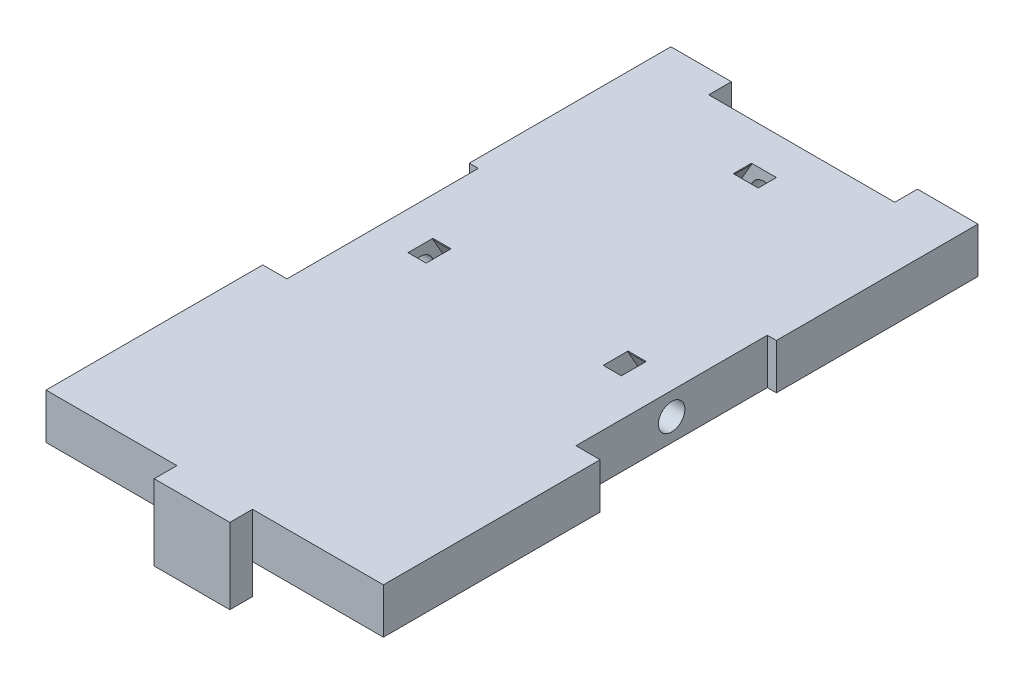
from build123d import *

# Parameters (mm, degrees)
SALIENTE_EXTRUIR1_DEPTH = 6
CROQUIS2_W              = 10
CROQUIS2_H              = 10
SALIENTE_EXTRUIR2_DEPTH = 3
CORTAR_EXTRUIR1_DEPTH   = 2.4
CORTAR_EXTRUIR2_REACH   = 85.843
CROQUIS4_R              = 1.75
CORTAR_EXTRUIR4_DEPTH   = 2.4
CORTAR_EXTRUIR5_REACH   = 62.207
CROQUIS7_R              = 1.75


with BuildPart() as part:
    # Croquis1 → Saliente-Extruir1 (new body)
    with BuildSketch(Plane(origin=(0, 0, 0), x_dir=(1, 0, 0), z_dir=(0, 1, 0))):
        Polygon((-12.3, 40.3), (-12.3, 37.3), (12.3, 37.3), (12.3, 40.3), (20.3, 40.3), (20.3, 13.65), (19.1, 13.65), (19.1, -11.65), (22.3, -11.65), (22.3, -40.3), (20.3, -40.3), (-20.3, -40.3), (-22.3, -40.3), (-22.3, -11.65), (-19.1, -11.65), (-19.1, 13.65), (-20.3, 13.65), (-20.3, 40.3), align=None)
    extrude(amount=SALIENTE_EXTRUIR1_DEPTH)

    # Croquis2 → Saliente-Extruir2 (add)
    with BuildSketch(Plane.XY.offset(40.3)):
        with Locations((0, 1)):
            Rectangle(CROQUIS2_W, CROQUIS2_H)
    extrude(amount=SALIENTE_EXTRUIR2_DEPTH)

    # Croquis3 → Cortar-Extruir1 (cut)
    with BuildSketch(Plane(origin=(0, 0, -32.3), x_dir=(-1, 0, 0), z_dir=(0, 0, -1))):
        Polygon((1.645448267, 5.85), (3.290896534, 3), (3.290896534, 0), (-3.290896534, 0), (-3.290896534, 3), (-1.645448267, 5.85), (-1.645448267, 6), (1.645448267, 6), align=None)
    extrude(amount=-CORTAR_EXTRUIR1_DEPTH, mode=Mode.SUBTRACT)

    # Croquis4 → Cortar-Extruir2 (cut, up to next)
    with BuildSketch(Plane(origin=(0, 0, -37.3), x_dir=(-1, 0, 0), z_dir=(0, 0, -1)), mode=Mode.PRIVATE) as cortar_extruir2_sk1:
        with Locations((0, 3)):
            Circle(CROQUIS4_R)
    cortar_extruir2_tool1 = extrude(cortar_extruir2_sk1.sketch, amount=-CORTAR_EXTRUIR2_REACH, mode=Mode.PRIVATE) & part.part
    add(cortar_extruir2_tool1.solids().sort_by_distance((0, 3, -37.3))[0], mode=Mode.SUBTRACT)

    # Croquis6 → Cortar-Extruir4 (cut)
    with BuildSketch(Plane.ZY.offset(14.1)):
        Polygon((0.645448267, 5.85), (2.290896534, 3), (2.290896534, 0), (-4.290896534, 0), (-4.290896534, 3), (-2.645448267, 5.85), (-2.645448267, 6), (0.645448267, 6), align=None)
    cortar_extruir4 = extrude(amount=-CORTAR_EXTRUIR4_DEPTH, mode=Mode.SUBTRACT)

    # Croquis7 → Cortar-Extruir5 (cut, up to next)
    with BuildSketch(Plane.ZY.offset(19.1), mode=Mode.PRIVATE) as cortar_extruir5_sk1:
        with Locations((-1, 3)):
            Circle(CROQUIS7_R)
    cortar_extruir5_tool1 = extrude(cortar_extruir5_sk1.sketch, amount=-CORTAR_EXTRUIR5_REACH, mode=Mode.PRIVATE) & part.part
    cortar_extruir5 = cortar_extruir5_tool1.solids().sort_by_distance((-19.1, 3, -1))[0]
    add(cortar_extruir5, mode=Mode.SUBTRACT)

    # Simetría1: Cortar-Extruir4, Cortar-Extruir5 across plane
    add(cortar_extruir4.mirror(Plane(origin=(0, 0, 0), x_dir=(0, 0, 1), z_dir=(1, 0, 0))), mode=Mode.SUBTRACT)
    add(cortar_extruir5.mirror(Plane(origin=(0, 0, 0), x_dir=(0, 0, 1), z_dir=(1, 0, 0))), mode=Mode.SUBTRACT)


solid = part.part
